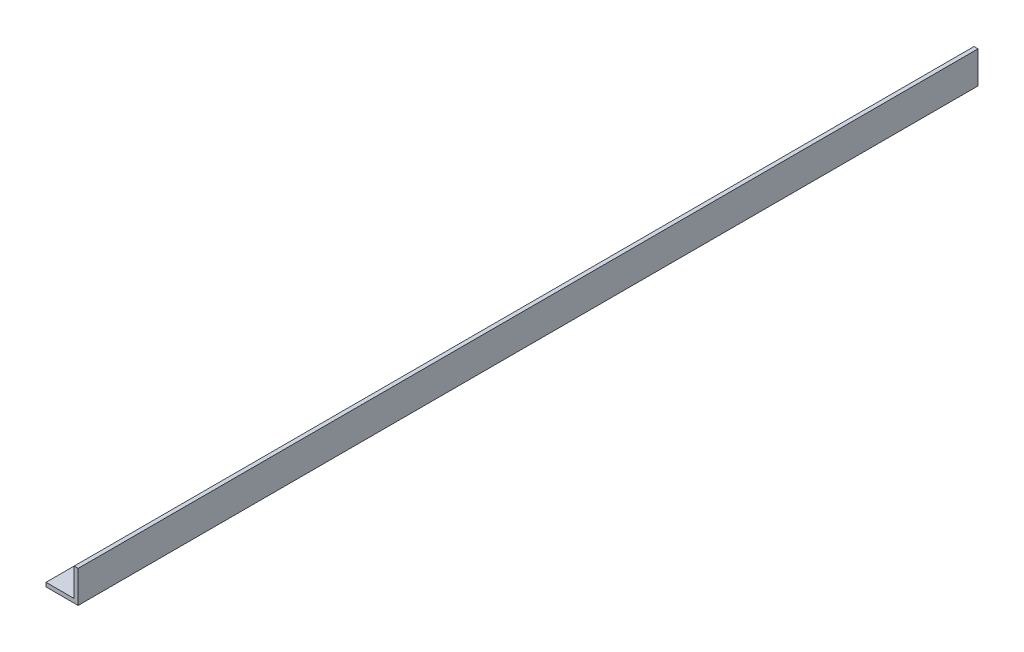
from build123d import *

# Parameters (mm, degrees)
BOSS_EXTRUDE1_DEPTH = 355.6


with BuildPart() as part:
    # Sketch2 → Boss-Extrude1 (new body)
    with BuildSketch(Plane.XY):
        Polygon((0, 0), (-12.7, 0), (-12.7, 1.5875), (-1.5875, 1.5875), (-1.5875, 12.7), (0, 12.7), align=None)
    extrude(amount=BOSS_EXTRUDE1_DEPTH)


solid = part.part
